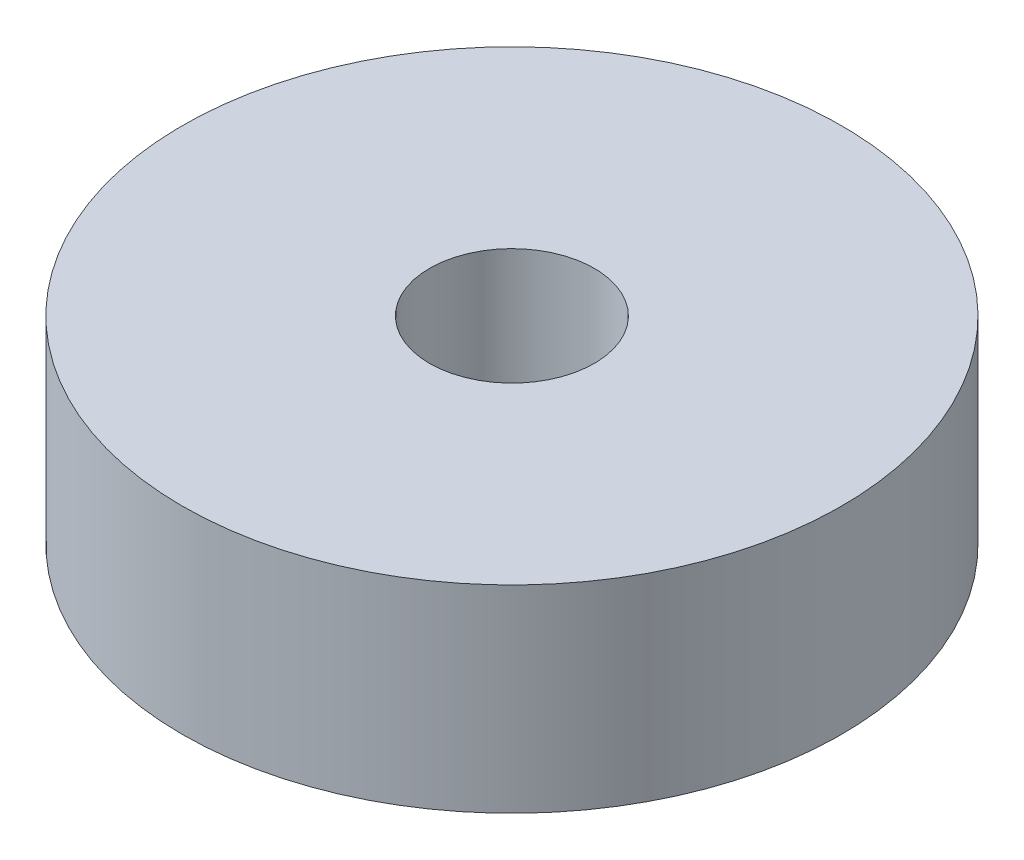
from build123d import *

# Parameters (mm, degrees)
SKETCH1_R           = 100
BOSS_EXTRUDE1_DEPTH = 60
SKETCH2_R           = 25
CUT_EXTRUDE1_DEPTH  = 50


with BuildPart() as part:
    # Sketch1 → Boss-Extrude1 (new body)
    with BuildSketch(Plane(origin=(0, 0, 0), x_dir=(1, 0, 0), z_dir=(0, 1, 0))):
        with Locations(Location((0, 0, 0), (0, 0, 270))):
            Circle(SKETCH1_R)
    extrude(amount=BOSS_EXTRUDE1_DEPTH)

    # Sketch2 → Cut-Extrude1 (cut)
    with BuildSketch(Plane(origin=(0, 60, 0), x_dir=(1, 0, 0), z_dir=(0, 1, 0))):
        with Locations(Location((0, 0, 0), (0, 0, 270))):
            Circle(SKETCH2_R)
    extrude(amount=-CUT_EXTRUDE1_DEPTH, mode=Mode.SUBTRACT)


solid = part.part
